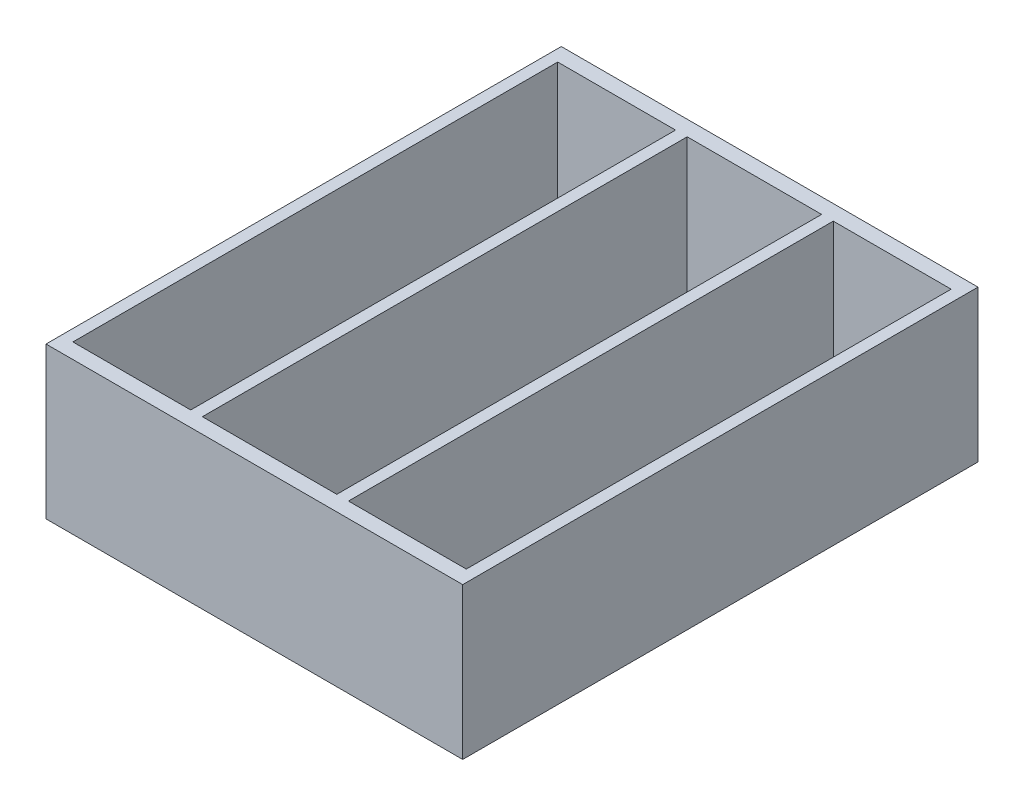
from build123d import *

# Parameters (mm, degrees)
SKETCH_1_W          = 46.5
SKETCH_1_H          = 57.5
EXTRUDE_1_DEPTH     = 1.6
SKETCH_2_W          = 46.5
SKETCH_2_H          = 57.5
SKETCH_2_W_2        = 13.15
SKETCH_2_H_2        = 54.1
SKETCH_2_W_3        = 15
EXTRUDE_2_DEPTH     = 15.3
SKETCH_3_R          = 1.5
CUT_EXTRUDE_1_DEPTH = 41.653843607
CUT_EXTRUDE_START   = -1.6
SKETCH_3_3_R        = 2.5
CUT_EXTRUDE_2_DEPTH = 0.8


with BuildPart() as part:
    # 草图1 → 凸台-拉伸1 (new body)
    with BuildSketch(Plane(origin=(0, 0, 0), x_dir=(1, 0, 0), z_dir=(0, 1, 0))):
        Rectangle(SKETCH_1_W, SKETCH_1_H)
    extrude(amount=EXTRUDE_1_DEPTH)

    # 草图2 → 凸台-拉伸2 (add)
    with BuildSketch(Plane(origin=(0, 1.6, 0), x_dir=(1, 0, 0), z_dir=(0, 1, 0))):
        Rectangle(SKETCH_2_W, SKETCH_2_H)
        with Locations((-15.375, 0)):
            Rectangle(SKETCH_2_W_2, SKETCH_2_H_2, mode=Mode.SUBTRACT)
        Rectangle(SKETCH_2_W_3, SKETCH_2_H_2, mode=Mode.SUBTRACT)
        with Locations((15.375, 0)):
            Rectangle(SKETCH_2_W_2, SKETCH_2_H_2, mode=Mode.SUBTRACT)
    extrude(amount=EXTRUDE_2_DEPTH)

    # 草图3 → 切除-拉伸1 (cut, through all)
    with BuildSketch(Plane.XZ):
        with Locations(Location((-15.1, 0, 0), (0, 0, 270))):
            Circle(SKETCH_3_R)
        with Locations(Location((15.1, 0, 0), (0, 0, 270))):
            Circle(SKETCH_3_R)
    extrude(amount=-CUT_EXTRUDE_1_DEPTH, mode=Mode.SUBTRACT)

    # 草图3<3> → 切除-拉伸2 (cut)
    with BuildSketch(Plane.XZ.offset(CUT_EXTRUDE_START)):
        with Locations(Location((-15.1, 0, 0), (0, 0, 90))):
            Circle(SKETCH_3_3_R)
        with Locations(Location((15.1, 0, 0), (0, 0, 90))):
            Circle(SKETCH_3_3_R)
    extrude(amount=CUT_EXTRUDE_2_DEPTH, mode=Mode.SUBTRACT)


solid = part.part
